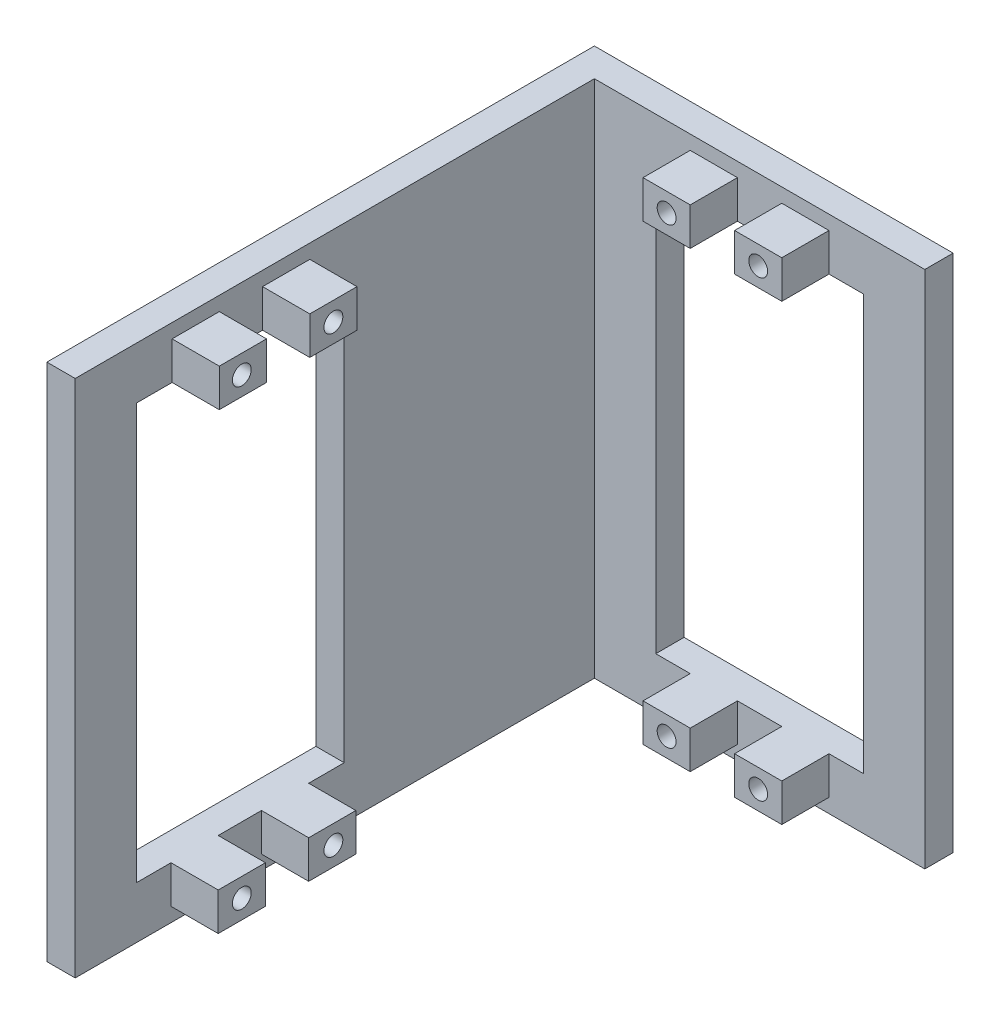
from build123d import *

# Parameters (mm, degrees)
BOSS_EXTRUDE1_DEPTH = 27.5
SKETCH3_R           = 1
SKETCH3_W           = 22
SKETCH3_H           = 44
CUT_EXTRUDE1_DEPTH  = 3
SKETCH4_R           = 1
SKETCH4_W           = 22
SKETCH4_H           = 44
CUT_EXTRUDE2_DEPTH  = 3
SKETCH5_W           = 5
SKETCH5_H           = 4
BOSS_EXTRUDE2_DEPTH = 5
CUT_EXTRUDE3_START  = -5
SKETCH6_R           = 1
CUT_EXTRUDE3_DEPTH  = 5
BOSS_EXTRUDE3_START = 5
SKETCH7_W           = 5
SKETCH7_H           = 4
SKETCH7_R           = 1
BOSS_EXTRUDE3_DEPTH = 5


with BuildPart() as part:
    # Sketch1 → Boss-Extrude1 (new, symmetric)
    with BuildSketch(Plane(origin=(0, 0, 0), x_dir=(1, 0, 0), z_dir=(0, 1, 0))):
        Polygon((38, 0), (0, 0), (0, -58), (3, -58), (3, -3), (38, -3), align=None)
    extrude(amount=BOSS_EXTRUDE1_DEPTH, both=True)

    # Sketch3 → Cut-Extrude1 (cut)
    with BuildSketch(Plane.XY.offset(3)):
        with Locations((15.65, -24)):
            Circle(SKETCH3_R)
        with Locations((25.35, -24)):
            Circle(SKETCH3_R)
        with Locations((25.35, 24)):
            Circle(SKETCH3_R)
        with Locations((15.65, 24)):
            Circle(SKETCH3_R)
        with Locations((20.5, 0)):
            Rectangle(SKETCH3_W, SKETCH3_H)
    extrude(amount=-CUT_EXTRUDE1_DEPTH, mode=Mode.SUBTRACT)

    # Sketch4 → Cut-Extrude2 (cut)
    with BuildSketch(Plane(origin=(3, 0, 0), x_dir=(0, 0, -1), z_dir=(1, 0, 0))):
        with Locations((-45.35, -24)):
            Circle(SKETCH4_R)
        with Locations((-35.65, -24)):
            Circle(SKETCH4_R)
        with Locations((-35.65, 24)):
            Circle(SKETCH4_R)
        with Locations((-45.35, 24)):
            Circle(SKETCH4_R)
        with Locations((-40.5, 0)):
            Rectangle(SKETCH4_W, SKETCH4_H)
    extrude(amount=-CUT_EXTRUDE2_DEPTH, mode=Mode.SUBTRACT)

    # Sketch5 → Boss-Extrude2 (add)
    with BuildSketch(Plane(origin=(3, 0, 0), x_dir=(0, 0, -1), z_dir=(1, 0, 0))):
        with Locations((-45.35, -24)):
            Rectangle(SKETCH5_W, SKETCH5_H)
        with Locations((-35.765327537, -24)):
            Rectangle(SKETCH5_W, SKETCH5_H)
        with Locations((-35.65, 24)):
            Rectangle(SKETCH5_W, SKETCH5_H)
        with Locations((-45.234672463, 24)):
            Rectangle(SKETCH5_W, SKETCH5_H)
    extrude(amount=BOSS_EXTRUDE2_DEPTH)

    # Sketch6 → Cut-Extrude3 (cut)
    with BuildSketch(Plane.ZY.offset(-3).offset(CUT_EXTRUDE3_START)):
        with Locations(Location((35.65, -24, 0), (0, 0, 180))):
            Circle(SKETCH6_R)
        with Locations(Location((45.35, -24, 0), (0, 0, 180))):
            Circle(SKETCH6_R)
        with Locations(Location((45.35, 24, 0), (0, 0, 180))):
            Circle(SKETCH6_R)
        with Locations(Location((35.65, 24, 0), (0, 0, 180))):
            Circle(SKETCH6_R)
    extrude(amount=CUT_EXTRUDE3_DEPTH, mode=Mode.SUBTRACT)

    # Sketch7 → Boss-Extrude3 (add)
    # profile 1 of 4: a face of its own
    with BuildSketch(Plane.XY.offset(3).offset(BOSS_EXTRUDE3_START)):
        with Locations((15.65, -24)):
            Rectangle(SKETCH7_W, SKETCH7_H)
        with Locations((15.65, -24)):
            Circle(SKETCH7_R, mode=Mode.SUBTRACT)
    # profile 2 of 4: a face of its own
    with BuildSketch(Plane.XY.offset(3).offset(BOSS_EXTRUDE3_START)):
        with Locations((25.35, -24)):
            Rectangle(SKETCH7_W, SKETCH7_H)
        with Locations((25.35, -24)):
            Circle(SKETCH7_R, mode=Mode.SUBTRACT)
    # profile 3 of 4: a face of its own
    with BuildSketch(Plane.XY.offset(3).offset(BOSS_EXTRUDE3_START)):
        with Locations((25.35, 24)):
            Rectangle(SKETCH7_W, SKETCH7_H)
        with Locations((25.35, 24)):
            Circle(SKETCH7_R, mode=Mode.SUBTRACT)
    # profile 4 of 4: a face of its own
    with BuildSketch(Plane.XY.offset(3).offset(BOSS_EXTRUDE3_START)):
        with Locations((15.65, 24)):
            Rectangle(SKETCH7_W, SKETCH7_H)
        with Locations((15.65, 24)):
            Circle(SKETCH7_R, mode=Mode.SUBTRACT)
    extrude(amount=-BOSS_EXTRUDE3_DEPTH)


solid = part.part
